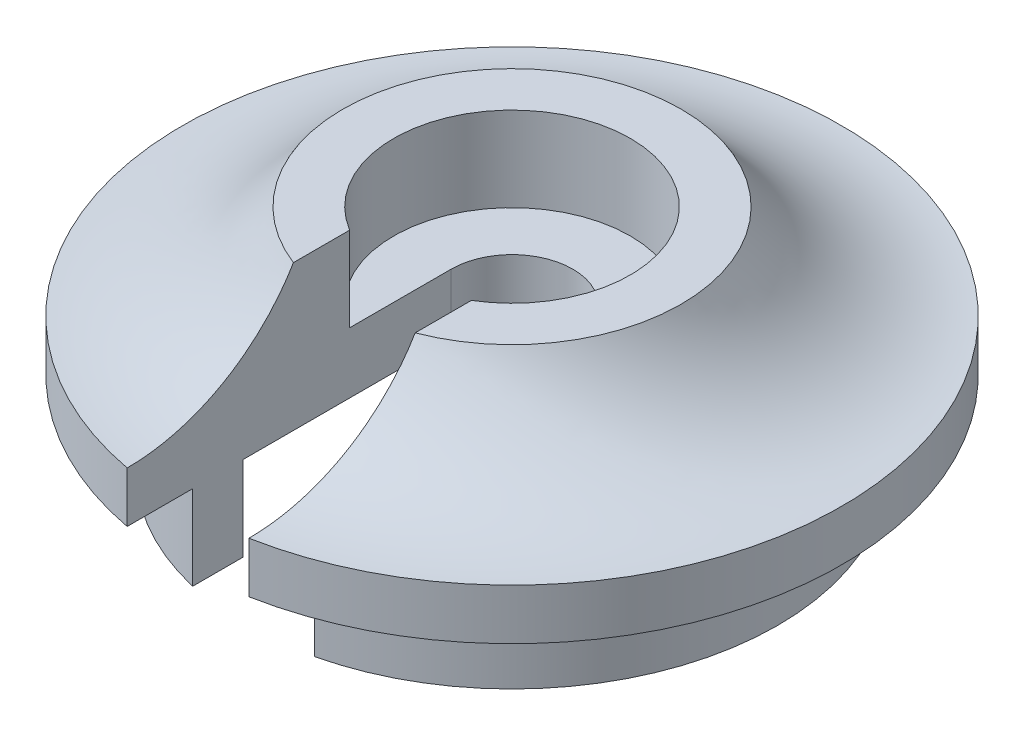
from build123d import *

# Parameters (mm, degrees)
TAGLIO_ESTRUSIONE1_DEPTH = 16.374166644


with BuildPart() as part:
    # Schizzo1 → Rivoluzione1 (revolve)
    with BuildSketch(Plane.XY, mode=Mode.PRIVATE) as rivoluzione1_sk:
        with BuildLine():
            Line((0, 0), (-6.415, 0))
            Line((-6.415, 0), (-6.415, -2.5))
            Line((-6.415, -2.5), (-7.855, -2.5))
            Line((-7.855, -2.5), (-7.855, 0))
            Line((-7.855, 0), (-9.75, 0))
            Line((-9.75, 0), (-9.75, 1.5))
            ThreePointArc((-9.75, 1.5), (-6.993076896, 2.252094735), (-5, 4.3))
            Line((-5, 4.3), (-3.5, 4.3))
            Line((-3.5, 4.3), (-3.5, 1.8))
            Line((-3.5, 1.8), (0, 1.8))
            Line((0, 1.8), (0, 0))
        make_face()
    revolve(rivoluzione1_sk.sketch.rotate(Axis((0, -12.420504762, 0), (0, 1, 0)), 270), axis=Axis((0, -12.420504762, 0), (0, 1, 0)))

    # Schizzo2 → Taglio-Estrusione1 (cut, through all)
    with BuildSketch(Plane(origin=(0, 4.3, 0), x_dir=(1, 0, 0), z_dir=(0, 1, 0))):
        with BuildLine():
            Line((1.8, -9.582405752), (1.8, 0))
            ThreePointArc((1.8, 0), (0, 1.8), (-1.8, 0))
            Line((-1.8, 0), (-1.8, -9.582405752))
            ThreePointArc((-1.8, -9.582405752), (0, -9.75), (1.8, -9.582405752))
        make_face()
    extrude(amount=-TAGLIO_ESTRUSIONE1_DEPTH, mode=Mode.SUBTRACT)


solid = part.part
